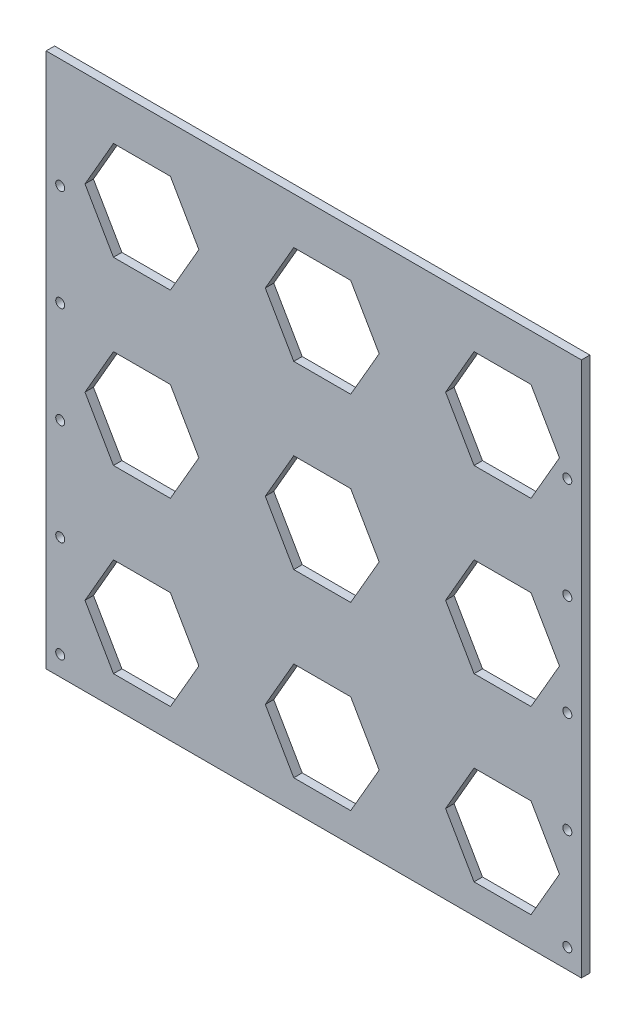
from build123d import *

# Parameters (mm, degrees)
SKETCH_1_W          = 190
SKETCH_1_H          = 190
EXTRUDE_1_DEPTH     = 3
CUT_EXTRUDE_1_DEPTH = 3
SKETCH_3_R          = 1.6
CUT_EXTRUDE_2_DEPTH = 10


with BuildPart() as part:
    # 草图1 → 凸台-拉伸1 (new body)
    with BuildSketch(Plane.XY):
        with Locations((95, -95)):
            Rectangle(SKETCH_1_W, SKETCH_1_H)
    extrude(amount=EXTRUDE_1_DEPTH)

    # 草图2 → 切除-拉伸1 (cut)
    with BuildSketch(Plane.XY.offset(3)):
        Polygon((54.207259422, -34), (44.103629711, -16.5), (23.896370289, -16.5), (13.792740578, -34), (23.896370289, -51.5), (44.103629711, -51.5), align=None)
        Polygon((108.103629711, -16.5), (87.896370289, -16.5), (77.792740578, -34), (87.896370289, -51.5), (108.103629711, -51.5), (118.207259422, -34), align=None)
        Polygon((172.103629711, -16.5), (151.896370289, -16.5), (141.792740578, -34), (151.896370289, -51.5), (172.103629711, -51.5), (182.207259422, -34), align=None)
        Polygon((108.103629711, -80.5), (87.896370289, -80.5), (77.792740578, -98), (87.896370289, -115.5), (108.103629711, -115.5), (118.207259422, -98), align=None)
        Polygon((172.103629711, -80.5), (151.896370289, -80.5), (141.792740578, -98), (151.896370289, -115.5), (172.103629711, -115.5), (182.207259422, -98), align=None)
        Polygon((108.103629711, -144.5), (87.896370289, -144.5), (77.792740578, -162), (87.896370289, -179.5), (108.103629711, -179.5), (118.207259422, -162), align=None)
        Polygon((172.103629711, -144.5), (151.896370289, -144.5), (141.792740578, -162), (151.896370289, -179.5), (172.103629711, -179.5), (182.207259422, -162), align=None)
        Polygon((44.103629711, -80.5), (23.896370289, -80.5), (13.792740578, -98), (23.896370289, -115.5), (44.103629711, -115.5), (54.207259422, -98), align=None)
        Polygon((44.103629711, -144.5), (23.896370289, -144.5), (13.792740578, -162), (23.896370289, -179.5), (44.103629711, -179.5), (54.207259422, -162), align=None)
    extrude(amount=-CUT_EXTRUDE_1_DEPTH, mode=Mode.SUBTRACT)

    # 草图3 → 切除-拉伸2 (cut)
    with BuildSketch(Plane.XY.offset(3)):
        with Locations((5, -75)):
            Circle(SKETCH_3_R)
        with Locations((185, -75)):
            Circle(SKETCH_3_R)
        with Locations((5, -111)):
            Circle(SKETCH_3_R)
        with Locations((185, -111)):
            Circle(SKETCH_3_R)
        with Locations((5, -147)):
            Circle(SKETCH_3_R)
        with Locations((185, -147)):
            Circle(SKETCH_3_R)
        with Locations((5, -183)):
            Circle(SKETCH_3_R)
        with Locations((185, -183)):
            Circle(SKETCH_3_R)
        with Locations((5, -39)):
            Circle(SKETCH_3_R)
        with Locations((185, -39)):
            Circle(SKETCH_3_R)
    extrude(amount=-CUT_EXTRUDE_2_DEPTH, mode=Mode.SUBTRACT)


solid = part.part
